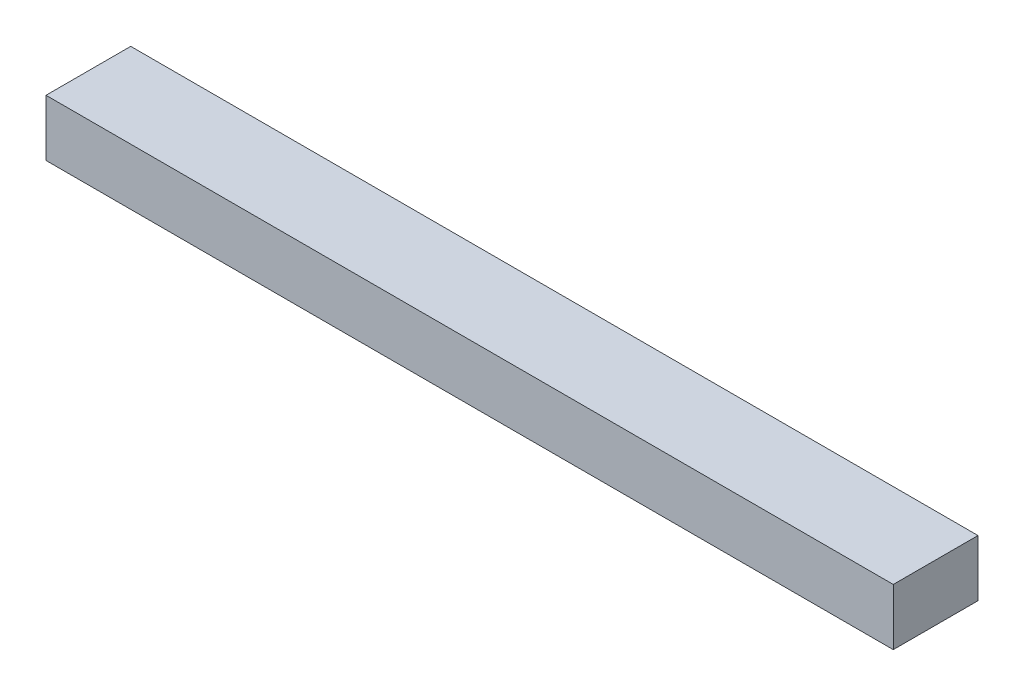
from build123d import *

# Parameters (mm, degrees)
SKETCH1_W           = 30
SKETCH1_H           = 20
BOSS_EXTRUDE1_DEPTH = 300


with BuildPart() as part:
    # Sketch1 → Boss-Extrude1 (new body)
    with BuildSketch(Plane(origin=(0, 0, 0), x_dir=(0, 0, -1), z_dir=(1, 0, 0))):
        with Locations((3.209264664, -3.823529412)):
            Rectangle(SKETCH1_W, SKETCH1_H)
    extrude(amount=BOSS_EXTRUDE1_DEPTH)


solid = part.part
